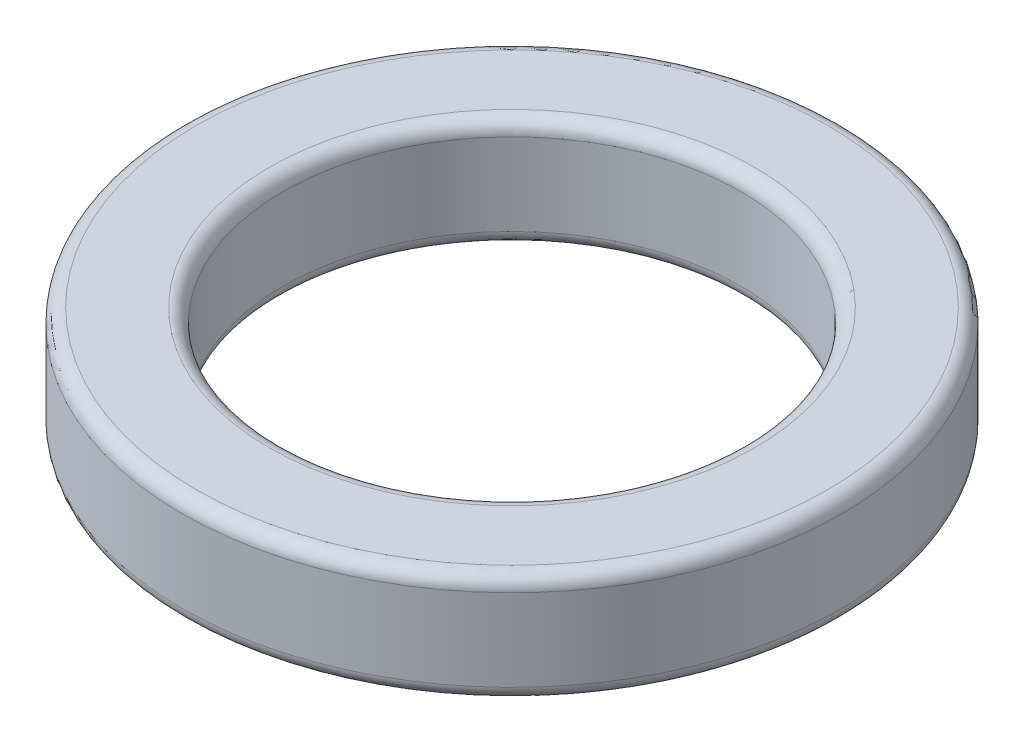
from build123d import *

# Parameters (mm, degrees)
SKETCH1_R           = 36
SKETCH1_R_2         = 25
BOSS_EXTRUDE1_DEPTH = 6
FILLET1_R           = 1.524


with BuildPart() as part:
    # Sketch1 → Boss-Extrude1 (new, symmetric)
    with BuildSketch(Plane(origin=(0, 0, 0), x_dir=(1, 0, 0), z_dir=(0, 1, 0))):
        with Locations(Location((0, 0, 0), (0, 0, 270))):
            Circle(SKETCH1_R)
        with Locations(Location((0, 0, 0), (0, 0, 270))):
            Circle(SKETCH1_R_2, mode=Mode.SUBTRACT)
    extrude(amount=BOSS_EXTRUDE1_DEPTH, both=True)

    # Fillet1
    fillet1_edges = [part.edges().sort_by_distance(p)[0] for p in [
        (0, -6, -36),
        (0, 6, -36),
        (0, -6, -25),
        (0, 6, -25),
    ]]
    fillet(fillet1_edges, radius=FILLET1_R)


solid = part.part
